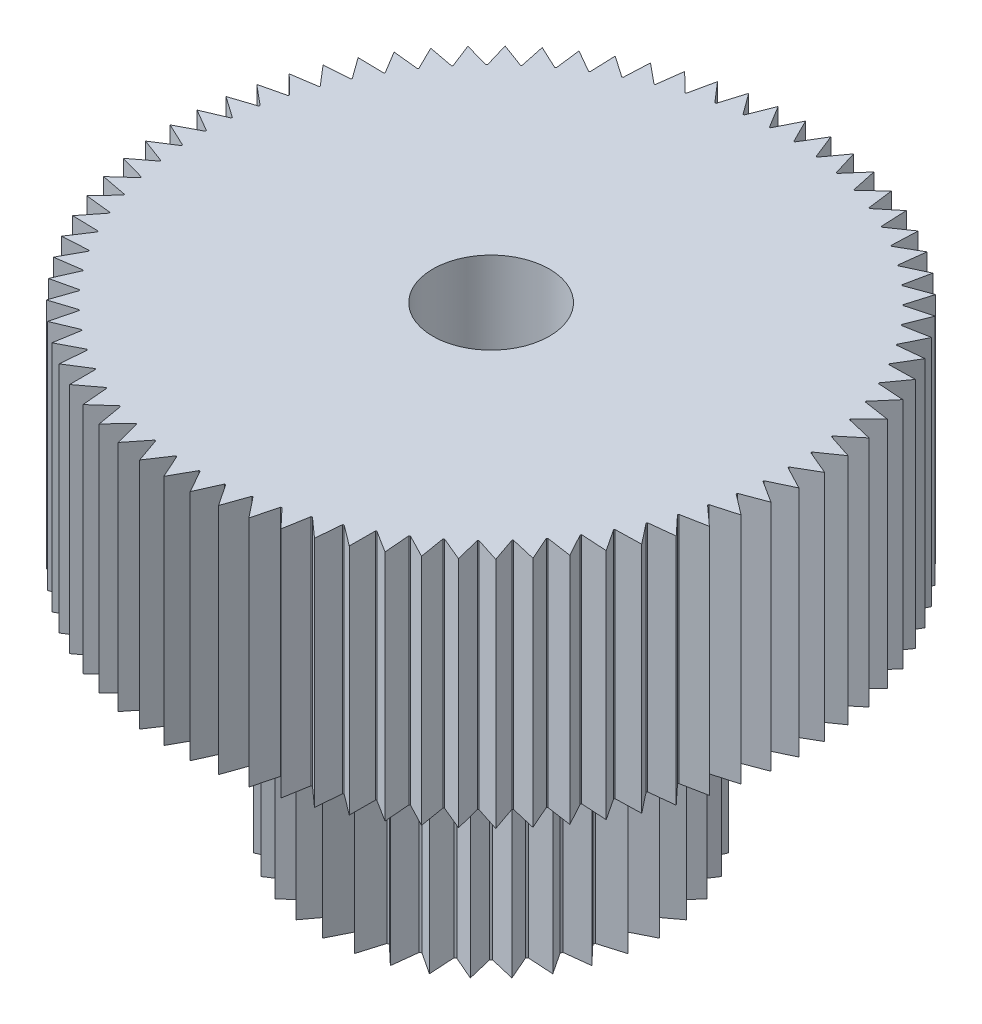
from build123d import *

# Parameters (mm, degrees)
SKETCH1_R           = 5
BOSS_EXTRUDE1_DEPTH = 4
BOSS_EXTRUDE2_DEPTH = 4
SKETCH5_R           = 2.5
BOSS_EXTRUDE3_DEPTH = 4
BOSS_EXTRUDE4_DEPTH = 4
SKETCH7_R           = 1
CUT_EXTRUDE2_DEPTH  = 12.055352878


with BuildPart() as part:
    # Sketch1 → Boss-Extrude1 (new body)
    with BuildSketch(Plane(origin=(0, 0, 0), x_dir=(1, 0, 0), z_dir=(0, 1, 0))):
        with Locations(Location((0, 0, 0), (0, 0, 270))):
            Circle(SKETCH1_R)
    extrude(amount=BOSS_EXTRUDE1_DEPTH)

    # Sketch3 → Boss-Extrude2 (add)
    with BuildSketch(Plane(origin=(0, 4, 0), x_dir=(1, 0, 0), z_dir=(0, 1, 0))):
        Polygon((-0.2, 4.995998399), (0.2, 4.995998399), (0, 5.395998399), align=None)
        Polygon((0.218755799, 4.995212298), (0.451525509, 5.377073873), (0.617352943, 4.96174116), align=None)
        Polygon((0.635977184, 4.959388372), (0.89988389, 5.320433037), (1.030375599, 4.892680873), align=None)
        Polygon((1.048737646, 4.888777899), (1.341930233, 5.226473186), (1.43617091, 4.789301945), align=None)
        Polygon((1.454141966, 4.783876163), (1.774563899, 5.095853382), (1.831892515, 4.652329504), align=None)
        Polygon((1.849346526, 4.645418972), (2.194750275, 4.929489827), (2.214764709, 4.482724315), align=None)
        Polygon((2.231579248, 4.474377505), (2.599542054, 4.728549442), (2.58210192, 4.281676035), align=None)
        Polygon((2.598159046, 4.271951495), (2.986099914, 4.494441681), (2.931327542, 4.050594875), align=None)
        Polygon((2.946514624, 4.039560814), (3.351712428, 4.228808641), (3.259992007, 3.791101702), align=None)
        Polygon((3.27420252, 3.778835516), (3.693815087, 3.933513546), (3.565789971, 3.505016674), align=None)
        Polygon((3.578924237, 3.491604403), (4.010008288, 3.61062768), (3.846576479, 3.194346473), align=None)
        Polygon((3.858542372, 3.179882193), (4.298074162, 3.262415856), (4.100382018, 2.861270226), align=None)
        Polygon((4.111095605, 2.845855395), (4.555992134, 2.891320528), (4.325426323, 2.508124225), align=None)
        Polygon((4.334812456, 2.491866965), (4.781953094, 2.499944664), (4.52013087, 2.137385534), align=None)
        Polygon((4.528123712, 2.12039988), (4.97437209, 2.091033484), (4.683129946, 1.751654619), align=None)
        Polygon((4.689673434, 1.734059712), (5.131899439, 1.667455207), (4.813280231, 1.353637106), align=None)
        Polygon((4.818328466, 1.335556362), (5.253430201, 1.232180929), (4.909668814, 0.946124801), align=None)
        Polygon((4.913186386, 0.927685043), (5.338111925, 0.788263788), (4.971619597, 0.53197611), align=None)
        Polygon((4.973581833, 0.513306681), (5.385350628, 0.338817543), (4.998698041, 0.114095989), align=None)
        Polygon((4.999091178, 0.09532784), (5.394814967, -0.113005264), (4.99071421, -0.304584433), align=None)
        Polygon((4.989535489, -0.323319656), (5.366438555, -0.56403542), (4.947724104, -0.721128414), align=None)
        Polygon((4.944981795, -0.739699297), (5.300420432, -1.011109273), (4.870029269, -1.132614198), align=None)
        Polygon((4.865742606, -1.15089048), (5.197223668, -1.451090921), (4.758174677, -1.536155507), align=None)
        Polygon((4.752373728, -1.554008992), (5.057572114, -1.880894209), (4.612944909, -1.928921788), align=None)
        Polygon((4.605670364, -1.946227248), (4.882445326, -2.297504375), (4.435358647, -2.308158069), align=None)
        Polygon((4.426661531, -2.324794119), (4.673071692, -2.697999199), (4.226661531, -2.67120428), align=None)
        Polygon((4.216602847, -2.687054228), (4.430919818, -3.079569497), (3.98831742, -3.015513912), align=None)
        Polygon((3.976967725, -3.030466584), (4.157688224, -3.439538828), (3.721998129, -3.338671881), align=None)
        Polygon((3.709437031, -3.352622393), (3.855293435, -3.775382265), (3.429571695, -3.638411465), align=None)
        Polygon((3.415887302, -3.651261965), (3.525856533, -4.084744108), (3.11308928, -3.912630207), align=None)
        Polygon((3.098377578, -3.924290558), (3.17168828, -4.365454406), (2.77477078, -4.159404659), align=None)
        Polygon((2.759134961, -4.169793072), (2.795272913, -4.615544178), (2.416989257, -4.377003876), align=None)
        Polygon((2.400538995, -4.386047484), (2.399250715, -4.833259224), (2.042254291, -4.563901556), align=None)
        Polygon((2.025104973, -4.571536924), (1.986399497, -5.017072429), (1.653194379, -4.718786745), align=None)
        Polygon((1.635466294, -4.724960317), (1.559615113, -5.165694476), (1.252538495, -4.840573036), align=None)
        Polygon((1.234355995, -4.845241509), (1.121891151, -5.278082887), (0.843096954, -4.928406185), align=None)
        Polygon((0.824587574, -4.931536812), (0.676297928, -5.35344934), (0.427741694, -4.981670106), align=None)
        Polygon((0.409035265, -4.983240929), (0.22596096, -5.391265191), (0.009386133, -4.99999119), align=None)
        Polygon((-0.009386133, -4.99999119), (-0.22596096, -5.391265191), (-0.409035265, -4.983240929), align=None)
        Polygon((-0.427741694, -4.981670106), (-0.676297928, -5.35344934), (-0.824587574, -4.931536812), align=None)
        Polygon((-0.843096954, -4.928406185), (-1.121891151, -5.278082887), (-1.234355995, -4.845241509), align=None)
        Polygon((-1.252538495, -4.840573036), (-1.559615113, -5.165694476), (-1.635466294, -4.724960317), align=None)
        Polygon((-1.653194379, -4.718786745), (-1.986399497, -5.017072429), (-2.025104973, -4.571536924), align=None)
        Polygon((-2.042254291, -4.563901556), (-2.399250715, -4.833259224), (-2.400538995, -4.386047484), align=None)
        Polygon((-2.416989257, -4.377003876), (-2.795272913, -4.615544178), (-2.759134961, -4.169793072), align=None)
        Polygon((-2.77477078, -4.159404659), (-3.17168828, -4.365454406), (-3.098377578, -3.924290558), align=None)
        Polygon((-3.11308928, -3.912630207), (-3.525856533, -4.084744108), (-3.415887302, -3.651261965), align=None)
        Polygon((-3.429571695, -3.638411465), (-3.855293435, -3.775382265), (-3.709437031, -3.352622393), align=None)
        Polygon((-3.721998129, -3.338671881), (-4.157688224, -3.439538828), (-3.976967725, -3.030466584), align=None)
        Polygon((-3.98831742, -3.015513912), (-4.430919818, -3.079569497), (-4.216602847, -2.687054228), align=None)
        Polygon((-4.226661531, -2.67120428), (-4.673071692, -2.697999199), (-4.426661531, -2.324794119), align=None)
        Polygon((-4.435358647, -2.308158069), (-4.882445326, -2.297504375), (-4.605670364, -1.946227248), align=None)
        Polygon((-4.612944909, -1.928921788), (-5.057572114, -1.880894209), (-4.752373728, -1.554008992), align=None)
        Polygon((-4.758174677, -1.536155507), (-5.197223668, -1.451090921), (-4.865742606, -1.15089048), align=None)
        Polygon((-4.870029269, -1.132614198), (-5.300420432, -1.011109273), (-4.944981795, -0.739699297), align=None)
        Polygon((-4.947724104, -0.721128414), (-5.366438555, -0.56403542), (-4.989535489, -0.323319656), align=None)
        Polygon((-4.99071421, -0.304584433), (-5.394814967, -0.113005264), (-4.999091178, 0.09532784), align=None)
        Polygon((-4.998698041, 0.114095989), (-5.385350628, 0.338817543), (-4.973581833, 0.513306681), align=None)
        Polygon((-4.971619597, 0.53197611), (-5.338111925, 0.788263788), (-4.913186386, 0.927685043), align=None)
        Polygon((-4.909668814, 0.946124801), (-5.253430201, 1.232180929), (-4.818328466, 1.335556362), align=None)
        Polygon((-4.813280231, 1.353637106), (-5.131899439, 1.667455207), (-4.689673434, 1.734059712), align=None)
        Polygon((-4.683129946, 1.751654619), (-4.97437209, 2.091033484), (-4.528123712, 2.12039988), align=None)
        Polygon((-4.52013087, 2.137385534), (-4.781953094, 2.499944664), (-4.334812456, 2.491866965), align=None)
        Polygon((-4.325426323, 2.508124225), (-4.555992134, 2.891320528), (-4.111095605, 2.845855395), align=None)
        Polygon((-4.100382018, 2.861270226), (-4.298074162, 3.262415856), (-3.858542372, 3.179882193), align=None)
        Polygon((-3.846576479, 3.194346473), (-4.010008288, 3.61062768), (-3.578924237, 3.491604403), align=None)
        Polygon((-3.565789971, 3.505016674), (-3.693815087, 3.933513546), (-3.27420252, 3.778835516), align=None)
        Polygon((-3.259992007, 3.791101702), (-3.351712428, 4.228808641), (-2.946514624, 4.039560814), align=None)
        Polygon((-2.931327542, 4.050594875), (-2.986099914, 4.494441681), (-2.598159046, 4.271951495), align=None)
        Polygon((-2.58210192, 4.281676035), (-2.599542054, 4.728549442), (-2.231579248, 4.474377505), align=None)
        Polygon((-2.214764709, 4.482724315), (-2.194750275, 4.929489827), (-1.849346526, 4.645418972), align=None)
        Polygon((-1.831892515, 4.652329504), (-1.774563899, 5.095853382), (-1.454141966, 4.783876163), align=None)
        Polygon((-1.43617091, 4.789301945), (-1.341930233, 5.226473186), (-1.048737646, 4.888777899), align=None)
        Polygon((-1.030375599, 4.892680873), (-0.89988389, 5.320433037), (-0.635977184, 4.959388372), align=None)
        Polygon((-0.617352943, 4.96174116), (-0.451525509, 5.377073873), (-0.218755799, 4.995212298), align=None)
    extrude(amount=-BOSS_EXTRUDE2_DEPTH)

    # Sketch5 → Boss-Extrude3 (add)
    with BuildSketch(Plane(origin=(0, 0, 0), x_dir=(-1, 0, 0), z_dir=(0, -1, 0))):
        with Locations(Location((0, 0, 0), (0, 0, 270))):
            Circle(SKETCH5_R)
    extrude(amount=BOSS_EXTRUDE3_DEPTH)

    # Sketch6 → Boss-Extrude4 (add)
    with BuildSketch(Plane.XZ.offset(4)):
        Polygon((-0.2, 2.491987159), (0.2, 2.491987159), (0, 2.891987159), align=None)
        Polygon((0.235767478, 2.48885791), (0.5021883, 2.848051376), (0.62969058, 2.419398639), align=None)
        Polygon((0.664371281, 2.410105973), (0.989117863, 2.717578993), (1.040248329, 2.273297916), align=None)
        Polygon((1.072788499, 2.258124185), (1.445993579, 2.504534347), (1.41919866, 2.058124185), align=None)
        Polygon((1.448609581, 2.037530437), (1.858933513, 2.215390693), (1.755027358, 1.780415393), align=None)
        Polygon((1.780415393, 1.755027358), (2.215390693, 1.858933513), (2.037530437, 1.448609581), align=None)
        Polygon((2.058124185, 1.41919866), (2.504534347, 1.445993579), (2.258124185, 1.072788499), align=None)
        Polygon((2.273297916, 1.040248329), (2.717578993, 0.989117863), (2.410105973, 0.664371281), align=None)
        Polygon((2.419398639, 0.62969058), (2.848051376, 0.5021883), (2.48885791, 0.235767478), align=None)
        Polygon((2.491987159, 0.2), (2.891987159, 0), (2.491987159, -0.2), align=None)
        Polygon((2.48885791, -0.235767478), (2.848051376, -0.5021883), (2.419398639, -0.62969058), align=None)
        Polygon((2.410105973, -0.664371281), (2.717578993, -0.989117863), (2.273297916, -1.040248329), align=None)
        Polygon((2.258124185, -1.072788499), (2.504534347, -1.445993579), (2.058124185, -1.41919866), align=None)
        Polygon((2.037530437, -1.448609581), (2.215390693, -1.858933513), (1.780415393, -1.755027358), align=None)
        Polygon((1.755027358, -1.780415393), (1.858933513, -2.215390693), (1.448609581, -2.037530437), align=None)
        Polygon((1.41919866, -2.058124185), (1.445993579, -2.504534347), (1.072788499, -2.258124185), align=None)
        Polygon((1.040248329, -2.273297916), (0.989117863, -2.717578993), (0.664371281, -2.410105973), align=None)
        Polygon((0.62969058, -2.419398639), (0.5021883, -2.848051376), (0.235767478, -2.48885791), align=None)
        Polygon((0.2, -2.491987159), (0, -2.891987159), (-0.2, -2.491987159), align=None)
        Polygon((-0.235767478, -2.48885791), (-0.5021883, -2.848051376), (-0.62969058, -2.419398639), align=None)
        Polygon((-0.664371281, -2.410105973), (-0.989117863, -2.717578993), (-1.040248329, -2.273297916), align=None)
        Polygon((-1.072788499, -2.258124185), (-1.445993579, -2.504534347), (-1.41919866, -2.058124185), align=None)
        Polygon((-1.448609581, -2.037530437), (-1.858933513, -2.215390693), (-1.755027358, -1.780415393), align=None)
        Polygon((-1.780415393, -1.755027358), (-2.215390693, -1.858933513), (-2.037530437, -1.448609581), align=None)
        Polygon((-2.058124185, -1.41919866), (-2.504534347, -1.445993579), (-2.258124185, -1.072788499), align=None)
        Polygon((-2.273297916, -1.040248329), (-2.717578993, -0.989117863), (-2.410105973, -0.664371281), align=None)
        Polygon((-2.419398639, -0.62969058), (-2.848051376, -0.5021883), (-2.48885791, -0.235767478), align=None)
        Polygon((-2.491987159, -0.2), (-2.891987159, 0), (-2.491987159, 0.2), align=None)
        Polygon((-2.48885791, 0.235767478), (-2.848051376, 0.5021883), (-2.419398639, 0.62969058), align=None)
        Polygon((-2.410105973, 0.664371281), (-2.717578993, 0.989117863), (-2.273297916, 1.040248329), align=None)
        Polygon((-2.258124185, 1.072788499), (-2.504534347, 1.445993579), (-2.058124185, 1.41919866), align=None)
        Polygon((-2.037530437, 1.448609581), (-2.215390693, 1.858933513), (-1.780415393, 1.755027358), align=None)
        Polygon((-1.755027358, 1.780415393), (-1.858933513, 2.215390693), (-1.448609581, 2.037530437), align=None)
        Polygon((-1.41919866, 2.058124185), (-1.445993579, 2.504534347), (-1.072788499, 2.258124185), align=None)
        Polygon((-1.040248329, 2.273297916), (-0.989117863, 2.717578993), (-0.664371281, 2.410105973), align=None)
        Polygon((-0.62969058, 2.419398639), (-0.5021883, 2.848051376), (-0.235767478, 2.48885791), align=None)
    extrude(amount=-BOSS_EXTRUDE4_DEPTH)

    # Sketch7 → Cut-Extrude2 (cut, through all)
    with BuildSketch(Plane(origin=(0, -4, 0), x_dir=(-1, 0, 0), z_dir=(0, -1, 0))):
        with Locations(Location((0, 0, 0), (0, 0, 90))):
            Circle(SKETCH7_R)
    extrude(amount=-CUT_EXTRUDE2_DEPTH, mode=Mode.SUBTRACT)


solid = part.part
